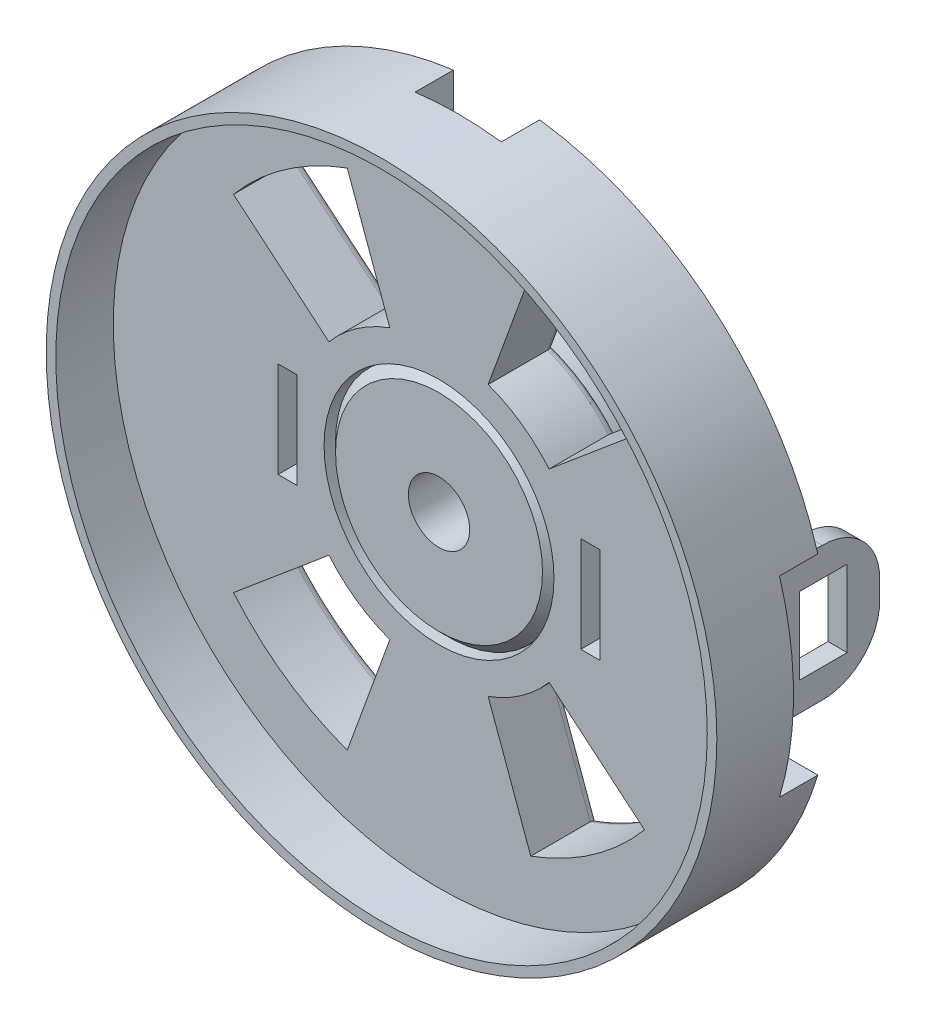
from build123d import *

# Parameters (mm, degrees)
SKETCH1_R               = 17.5
BOSS_EXTRUDE1_DEPTH     = 6
CUT_EXTRUDE1_DEPTH      = 10
BOSS_EXTRUDE2_START     = 0.5
BOSS_EXTRUDE2_DEPTH     = 0.5
FILLET2_R               = 0.4
SKETCH5_R               = 6.5
BOSS_EXTRUDE3_DEPTH     = 4.5
FILLET3_R               = 0.5
SKETCH6_R               = 6
CUT_EXTRUDE2_DEPTH      = 28.083205128
CHAMFER1_SIZE           = 0.5
SKETCH7_R               = 17
CUT_EXTRUDE3_DEPTH      = 3
CUT_EXTRUDE4_DEPTH      = 26.588083164
CUT_EXTRUDE4_DEPTH_BACK = 26.588083164
SKETCH8_W               = 1
SKETCH8_H               = 5
SKETCH9_R               = 5.9
BOSS_EXTRUDE4_DEPTH     = 8
CHAMFER2_SIZE           = 0.5
SKETCH10_R              = 1.6
CUT_EXTRUDE5_DEPTH      = 28.083205128
SKETCH11_W              = 6.880838965
SKETCH11_H              = 10
CUT_EXTRUDE6_DEPTH      = 2
SKETCH12_W              = 4.5
SKETCH12_H              = 5.419888483
CUT_EXTRUDE7_DEPTH      = 2
FILLET4_R               = 1
FILLET5_R               = 0.5
SKETCH13_W              = 1
SKETCH13_H              = 7
BOSS_EXTRUDE5_DEPTH     = 7
FILLET6_R               = 3
SKETCH14_W              = 2.5
SKETCH14_H              = 4
CUT_EXTRUDE8_DEPTH      = 3
CIRPATTERN1_COUNT       = 2


with BuildPart() as part:
    # Sketch1 → Boss-Extrude1 (new body)
    with BuildSketch(Plane.XY):
        Circle(SKETCH1_R)
    extrude(amount=BOSS_EXTRUDE1_DEPTH)

    # Sketch2 → Cut-Extrude1 (cut)
    with BuildSketch(Plane(origin=(0, 0, 0), x_dir=(-1, 0, 0), z_dir=(0, 0, -1))):
        with BuildLine():
            Line((2.565151075, 7.047694656), (4.788282007, 13.155696691))
            ThreePointArc((4.788282007, 13.155696691), (8.030070109, 11.46812862), (10.724622204, 8.999026536))
            Line((10.724622204, 8.999026536), (5.745333323, 4.820907073))
            ThreePointArc((5.745333323, 4.820907073), (4.301823273, 6.143640332), (2.565151075, 7.047694656))
        make_face()
        with BuildLine():
            Line((-5.745333323, 4.820907073), (-10.724622204, 8.999026536))
            ThreePointArc((-10.724622204, 8.999026536), (-8.030070109, 11.46812862), (-4.788282007, 13.155696691))
            Line((-4.788282007, 13.155696691), (-2.565151075, 7.047694656))
            ThreePointArc((-2.565151075, 7.047694656), (-4.301823273, 6.143640332), (-5.745333323, 4.820907073))
        make_face()
        with BuildLine():
            Line((-5.745333323, -4.820907073), (-10.724622204, -8.999026536))
            ThreePointArc((-10.724622204, -8.999026536), (-8.030070109, -11.46812862), (-4.788282007, -13.155696691))
            Line((-4.788282007, -13.155696691), (-2.565151075, -7.047694656))
            ThreePointArc((-2.565151075, -7.047694656), (-4.301823273, -6.143640332), (-5.745333323, -4.820907073))
        make_face()
        with BuildLine():
            Line((2.565151075, -7.047694656), (4.788282007, -13.155696691))
            ThreePointArc((4.788282007, -13.155696691), (8.030070109, -11.46812862), (10.724622204, -8.999026536))
            Line((10.724622204, -8.999026536), (5.745333323, -4.820907073))
            ThreePointArc((5.745333323, -4.820907073), (4.301823273, -6.143640332), (2.565151075, -7.047694656))
        make_face()
    extrude(amount=-CUT_EXTRUDE1_DEPTH, mode=Mode.SUBTRACT)

    # Sketch4 → Boss-Extrude2 (add)
    with BuildSketch(Plane(origin=(0, 0, 0), x_dir=(-1, 0, 0), z_dir=(0, 0, -1)).offset(BOSS_EXTRUDE2_START)):
        with BuildLine():
            Line((-3.487249633, 13.62366847), (-2.407827253, 10.657979857))
            ThreePointArc((-2.407827253, 10.657979857), (-2.041711069, 10.180847956), (-1.468134633, 10))
            Line((-1.468134633, 10), (1.468134633, 10))
            ThreePointArc((1.468134633, 10), (2.041711069, 10.180847956), (2.407827253, 10.657979857))
            Line((2.407827253, 10.657979857), (3.487249633, 13.62366847))
            ThreePointArc((3.487249633, 13.62366847), (3.991977404, 14.18209576), (4.743152415, 14.230337493))
            ThreePointArc((4.743152415, 14.230337493), (8.53250223, 12.336790737), (11.641349295, 9.459333305))
            ThreePointArc((11.641349295, 9.459333305), (11.85564371, 8.690368016), (11.438835779, 8.009559041))
            Line((11.438835779, 8.009559041), (10.426423564, 7.300660376))
            ThreePointArc((10.426423564, 7.300660376), (10.112989167, 6.943256945), (10, 6.481508332))
            Line((10, 6.481508332), (10, -6.481508332))
            ThreePointArc((10, -6.481508332), (10.112989167, -6.943256945), (10.426423564, -7.300660376))
            Line((10.426423564, -7.300660376), (11.438835779, -8.009559041))
            ThreePointArc((11.438835779, -8.009559041), (11.85564371, -8.690368016), (11.641349295, -9.459333305))
            ThreePointArc((11.641349295, -9.459333305), (8.53250223, -12.336790737), (4.743152415, -14.230337493))
            ThreePointArc((4.743152415, -14.230337493), (3.991977404, -14.18209576), (3.487249633, -13.62366847))
            Line((3.487249633, -13.62366847), (2.407827253, -10.657979857))
            ThreePointArc((2.407827253, -10.657979857), (2.041711069, -10.180847956), (1.468134633, -10))
            Line((1.468134633, -10), (-1.468134633, -10))
            ThreePointArc((-1.468134633, -10), (-2.041711069, -10.180847956), (-2.407827253, -10.657979857))
            Line((-2.407827253, -10.657979857), (-3.487249633, -13.62366847))
            ThreePointArc((-3.487249633, -13.62366847), (-3.991977404, -14.18209576), (-4.743152415, -14.230337493))
            ThreePointArc((-4.743152415, -14.230337493), (-8.53250223, -12.336790737), (-11.641349295, -9.459333305))
            ThreePointArc((-11.641349295, -9.459333305), (-11.85564371, -8.690368016), (-11.438835779, -8.009559041))
            Line((-11.438835779, -8.009559041), (-10.426423564, -7.300660376))
            ThreePointArc((-10.426423564, -7.300660376), (-10.112989167, -6.943256945), (-10, -6.481508332))
            Line((-10, -6.481508332), (-10, 6.481508332))
            ThreePointArc((-10, 6.481508332), (-10.112989167, 6.943256945), (-10.426423564, 7.300660376))
            Line((-10.426423564, 7.300660376), (-11.438835779, 8.009559041))
            ThreePointArc((-11.438835779, 8.009559041), (-11.85564371, 8.690368016), (-11.641349295, 9.459333305))
            ThreePointArc((-11.641349295, 9.459333305), (-8.53250223, 12.336790737), (-4.743152415, 14.230337493))
            ThreePointArc((-4.743152415, 14.230337493), (-3.991977404, 14.18209576), (-3.487249633, 13.62366847))
        make_face()
        with BuildLine():
            Line((-10.724622204, 8.999026536), (-5.745333323, 4.820907073))
            ThreePointArc((-5.745333323, 4.820907073), (-4.301823273, 6.143640332), (-2.565151075, 7.047694656))
            Line((-2.565151075, 7.047694656), (-4.788282007, 13.155696691))
            ThreePointArc((-4.788282007, 13.155696691), (-8.030070109, 11.46812862), (-10.724622204, 8.999026536))
        make_face(mode=Mode.SUBTRACT)
        with BuildLine():
            Line((2.565151075, -7.047694656), (4.788282007, -13.155696691))
            ThreePointArc((4.788282007, -13.155696691), (8.030070109, -11.46812862), (10.724622204, -8.999026536))
            Line((10.724622204, -8.999026536), (5.745333323, -4.820907073))
            ThreePointArc((5.745333323, -4.820907073), (4.301823273, -6.143640332), (2.565151075, -7.047694656))
        make_face(mode=Mode.SUBTRACT)
        with BuildLine():
            Line((4.788282007, 13.155696691), (2.565151075, 7.047694656))
            ThreePointArc((2.565151075, 7.047694656), (4.301823273, 6.143640332), (5.745333323, 4.820907073))
            Line((5.745333323, 4.820907073), (10.724622204, 8.999026536))
            ThreePointArc((10.724622204, 8.999026536), (8.030070109, 11.46812862), (4.788282007, 13.155696691))
        make_face(mode=Mode.SUBTRACT)
        with BuildLine():
            Line((-4.788282007, -13.155696691), (-2.565151075, -7.047694656))
            ThreePointArc((-2.565151075, -7.047694656), (-4.301823273, -6.143640332), (-5.745333323, -4.820907073))
            Line((-5.745333323, -4.820907073), (-10.724622204, -8.999026536))
            ThreePointArc((-10.724622204, -8.999026536), (-8.030070109, -11.46812862), (-4.788282007, -13.155696691))
        make_face(mode=Mode.SUBTRACT)
    extrude(amount=-BOSS_EXTRUDE2_DEPTH)

    # Fillet2
    fillet2_edges = [part.edges().sort_by_distance(p)[0] for p in [
        (8.234977764, -6.909966804, -0.5),
        (8.030070109, -11.46812862, -0.5),
        (3.676716541, -10.101695673, -0.5),
        (4.301823273, -6.143640332, -0.5),
        (-3.676716541, -10.101695673, -0.5),
        (-8.030070109, -11.46812862, -0.5),
        (-8.234977764, -6.909966804, -0.5),
        (-4.301823273, -6.143640332, -0.5),
        (8.53250223, 12.336790737, -0.5),
        (3.991977404, 14.18209576, -0.5),
        (2.947538443, 12.140824163, -0.5),
        (2.041711069, 10.180847956, -0.5),
        (0, 10, -0.5),
        (-2.041711069, 10.180847956, -0.5),
        (-2.947538443, 12.140824163, -0.5),
        (-3.991977404, 14.18209576, -0.5),
        (-8.53250223, 12.336790737, -0.5),
        (-11.85564371, 8.690368016, -0.5),
        (-10.932629671, 7.655109708, -0.5),
        (-10.112989167, 6.943256945, -0.5),
        (-10, 0, -0.5),
        (-10.112989167, -6.943256945, -0.5),
        (-10.932629671, -7.655109708, -0.5),
        (-11.85564371, -8.690368016, -0.5),
        (-8.53250223, -12.336790737, -0.5),
        (-3.991977404, -14.18209576, -0.5),
        (-2.947538443, -12.140824163, -0.5),
        (-2.041711069, -10.180847956, -0.5),
        (0, -10, -0.5),
        (2.041711069, -10.180847956, -0.5),
        (2.947538443, -12.140824163, -0.5),
        (3.991977404, -14.18209576, -0.5),
        (8.53250223, -12.336790737, -0.5),
        (11.85564371, -8.690368016, -0.5),
        (10.932629671, -7.655109708, -0.5),
        (10.112989167, -6.943256945, -0.5),
        (10, 0, -0.5),
        (10.112989167, 6.943256945, -0.5),
        (10.932629671, 7.655109708, -0.5),
        (11.85564371, 8.690368016, -0.5),
        (8.234977764, 6.909966804, -0.5),
        (4.301823273, 6.143640332, -0.5),
        (3.676716541, 10.101695673, -0.5),
        (8.030070109, 11.46812862, -0.5),
        (-3.676716541, 10.101695673, -0.5),
        (-4.301823273, 6.143640332, -0.5),
        (-8.234977764, 6.909966804, -0.5),
        (-8.030070109, 11.46812862, -0.5),
    ]]
    fillet(fillet2_edges, radius=FILLET2_R)

    # Sketch5 → Boss-Extrude3 (add)
    with BuildSketch(Plane(origin=(0, 0, -0.5), x_dir=(-1, 0, 0), z_dir=(0, 0, -1))):
        Circle(SKETCH5_R)
    extrude(amount=BOSS_EXTRUDE3_DEPTH)

    # Fillet3
    fillet3_edges = [part.edges().sort_by_distance(p)[0] for p in [
        (6.5, 0, -5),
    ]]
    fillet(fillet3_edges, radius=FILLET3_R)

    # Sketch6 → Cut-Extrude2 (cut, through all)
    with BuildSketch(Plane(origin=(0, 0, -5), x_dir=(-1, 0, 0), z_dir=(0, 0, -1))):
        Circle(SKETCH6_R)
    extrude(amount=-CUT_EXTRUDE2_DEPTH, mode=Mode.SUBTRACT)

    # Chamfer1
    chamfer1_edges = [part.edges().sort_by_distance(p)[0] for p in [
        (6, 0, 6),
    ]]
    chamfer(chamfer1_edges, length=CHAMFER1_SIZE)

    # Sketch7 → Cut-Extrude3 (cut)
    with BuildSketch(Plane.XY.offset(6)):
        Circle(SKETCH7_R)
    extrude(amount=-CUT_EXTRUDE3_DEPTH, mode=Mode.SUBTRACT)

    # Sketch8 → Cut-Extrude4 (cut, two sides: drawn at the far end of the back side and taken through both)
    with BuildSketch(Plane(origin=(0, 0, -0.5), x_dir=(-1, 0, 0), z_dir=(0, 0, -1)).offset(-CUT_EXTRUDE4_DEPTH_BACK)):
        with Locations((7.9, 0)):
            Rectangle(SKETCH8_W, SKETCH8_H)
        with Locations((-7.9, 0)):
            Rectangle(SKETCH8_W, SKETCH8_H)
    extrude(amount=CUT_EXTRUDE4_DEPTH + CUT_EXTRUDE4_DEPTH_BACK, mode=Mode.SUBTRACT)

    # Sketch11 → Cut-Extrude6 (cut)
    with BuildSketch(Plane(origin=(0, 0, 0), x_dir=(-1, 0, 0), z_dir=(0, 0, -1))):
        with Locations((-15.940419483, 0)):
            Rectangle(SKETCH11_W, SKETCH11_H)
        with Locations((15.940419483, 0)):
            Rectangle(SKETCH11_W, SKETCH11_H)
    extrude(amount=-CUT_EXTRUDE6_DEPTH, mode=Mode.SUBTRACT)

    # Sketch12 → Cut-Extrude7 (cut)
    with BuildSketch(Plane(origin=(0, 0, 0), x_dir=(-1, 0, 0), z_dir=(0, 0, -1))):
        with Locations((0, 16.709944242)):
            Rectangle(SKETCH12_W, SKETCH12_H)
        with Locations((0, -16.709944242)):
            Rectangle(SKETCH12_W, SKETCH12_H)
    extrude(amount=-CUT_EXTRUDE7_DEPTH, mode=Mode.SUBTRACT)

    # Fillet4
    fillet4_edges = [part.edges().sort_by_distance(p)[0] for p in [
        (12.5, -5, 1),
        (12.5, 5, 1),
        (-12.5, -5, 1),
        (-12.5, 5, 1),
    ]]
    fillet(fillet4_edges, radius=FILLET4_R)

    # Fillet5
    fillet5_edges = [part.edges().sort_by_distance(p)[0] for p in [
        (-2.25, -14, 1),
        (2.25, -14, 1),
        (-2.25, 14, 1),
        (2.25, 14, 1),
    ]]
    fillet(fillet5_edges, radius=FILLET5_R)

    # Sketch13 → Boss-Extrude5 (add)
    with BuildSketch(Plane(origin=(0, 0, 2), x_dir=(-1, 0, 0), z_dir=(0, 0, -1))):
        with Locations((-14.5, 0)):
            Rectangle(SKETCH13_W, SKETCH13_H)
        with Locations((14.5, 0)):
            Rectangle(SKETCH13_W, SKETCH13_H)
    extrude(amount=BOSS_EXTRUDE5_DEPTH)

    # Fillet6
    fillet6_edges = [part.edges().sort_by_distance(p)[0] for p in [
        (14.5, -3.5, -5),
        (14.5, 3.5, -5),
        (-14.5, -3.5, -5),
        (-14.5, 3.5, -5),
    ]]
    fillet(fillet6_edges, radius=FILLET6_R)

    # Sketch14 → Cut-Extrude8 (cut)
    with BuildSketch(Plane(origin=(15, 0, 0), x_dir=(0, 0, -1), z_dir=(1, 0, 0))):
        with Locations((2.05, 0)):
            Rectangle(SKETCH14_W, SKETCH14_H)
    cut_extrude8 = extrude(amount=-CUT_EXTRUDE8_DEPTH, mode=Mode.SUBTRACT)

    # CirPattern1: Cut-Extrude8 ×2 about axis
    cirpattern1_axis = Axis((0, 0, -4.5), (0, 0, 1))
    for i in range(1, CIRPATTERN1_COUNT):
        add(cut_extrude8.rotate(cirpattern1_axis, i * 360 / CIRPATTERN1_COUNT), mode=Mode.SUBTRACT)


with BuildPart() as body_2:
    # Sketch9 → Boss-Extrude4 (new body)
    with BuildSketch(Plane.XY.offset(3)):
        Circle(SKETCH9_R)
    extrude(amount=-BOSS_EXTRUDE4_DEPTH)

    # Chamfer2
    chamfer2_edges = [body_2.edges().sort_by_distance(p)[0] for p in [
        (-5.9, 0, 3),
        (-5.9, 0, -5),
    ]]
    chamfer(chamfer2_edges, length=CHAMFER2_SIZE)

    # Sketch10 → Cut-Extrude5 (cut, through all)
    with BuildSketch(Plane(origin=(0, 0, -5), x_dir=(-1, 0, 0), z_dir=(0, 0, -1))):
        Circle(SKETCH10_R)
    extrude(amount=-CUT_EXTRUDE5_DEPTH, mode=Mode.SUBTRACT)


solid = Compound([part.part, body_2.part])
